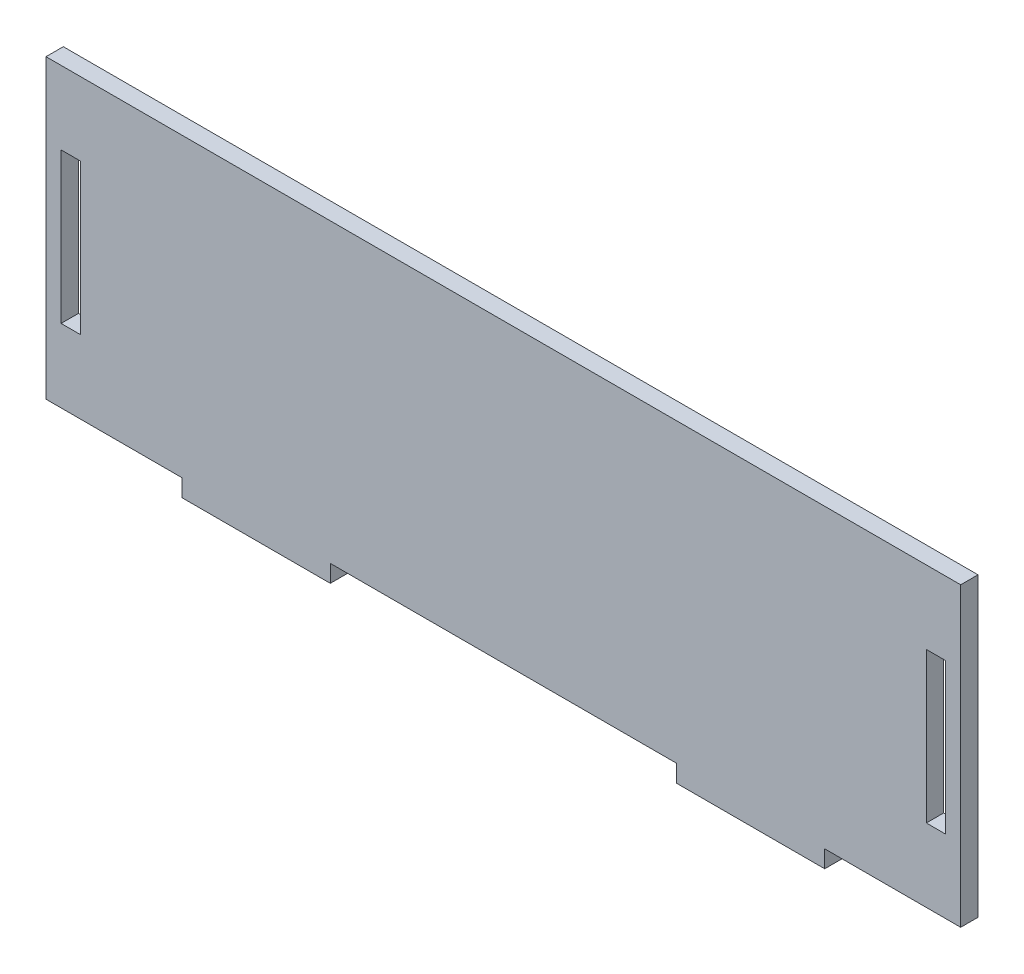
from build123d import *

# Parameters (mm, degrees)
SKETCH_1_W      = 185
SKETCH_1_H      = 60
SKETCH_1_W_2    = 3.9
SKETCH_1_H_2    = 30.4
SKETCH_1_W_3    = 30
SKETCH_1_H_3    = 3.5
EXTRUDE_1_DEPTH = 3.5


with BuildPart() as part:
    # Эскиз1 → Бобышка-Вытянуть1 (new body)
    # profile 1 of 3: a face of its own
    with BuildSketch(Plane.XY):
        with Locations((92.5, 30)):
            Rectangle(SKETCH_1_W, SKETCH_1_H)
        with Locations((180, 30)):
            Rectangle(SKETCH_1_W_2, SKETCH_1_H_2, mode=Mode.SUBTRACT)
        with Locations((5, 30)):
            Rectangle(SKETCH_1_W_2, SKETCH_1_H_2, mode=Mode.SUBTRACT)
    # profile 2 of 3: a face of its own
    with BuildSketch(Plane.XY):
        with Locations((42.5, -1.75)):
            Rectangle(SKETCH_1_W_3, SKETCH_1_H_3)
    # profile 3 of 3: a face of its own
    with BuildSketch(Plane.XY):
        with Locations((142.5, -1.75)):
            Rectangle(SKETCH_1_W_3, SKETCH_1_H_3)
    extrude(amount=EXTRUDE_1_DEPTH)


solid = part.part
